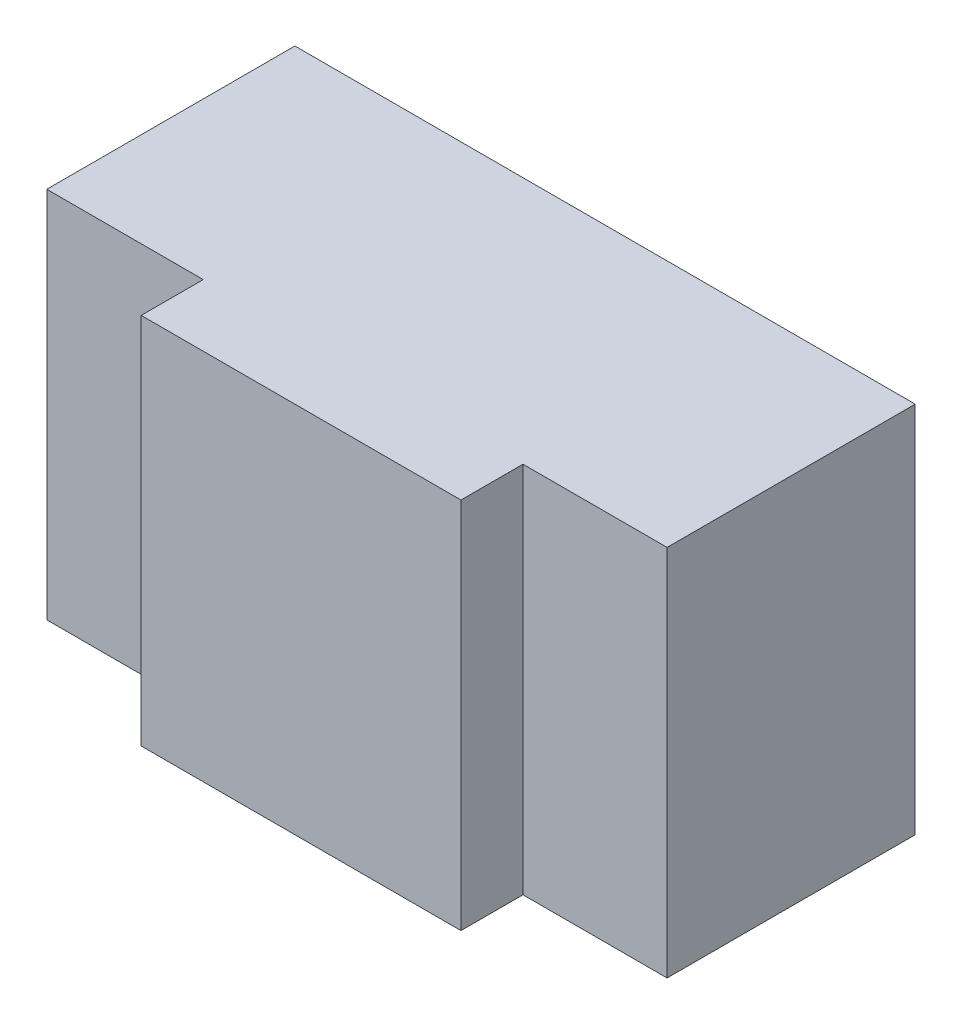
from build123d import *

# Parameters (mm, degrees)
SKETCH_1_W           = 1
SKETCH_1_H           = 0.601167315
EXTRUDE_1_DEPTH      = 0.5
SKETCH_2_OUTSIDE_W   = 3.254
SKETCH_2_OUTSIDE_H   = 2.855
SKETCH_2_OUTSIDE_W_2 = 0.515504071
SKETCH_2_OUTSIDE_H_2 = 0.601167315
CUT_EXTRUDE_1_DEPTH  = 0.1


with BuildPart() as part:
    # 草图1 → 凸台-拉伸1 (new body)
    with BuildSketch(Plane.XY):
        with Locations((-0.5, 0.300583658)):
            Rectangle(SKETCH_1_W, SKETCH_1_H)
    extrude(amount=EXTRUDE_1_DEPTH)

    # 草图2 outside → 切除-拉伸1 (cut)
    with BuildSketch(Plane.XY.offset(0.5)):
        with Locations((-0.5, 0.3005)):
            Rectangle(SKETCH_2_OUTSIDE_W, SKETCH_2_OUTSIDE_H)
        with Locations((-0.490043913, 0.300583658)):
            Rectangle(SKETCH_2_OUTSIDE_W_2, SKETCH_2_OUTSIDE_H_2, mode=Mode.SUBTRACT)
    extrude(amount=-CUT_EXTRUDE_1_DEPTH, mode=Mode.SUBTRACT)


solid = part.part
